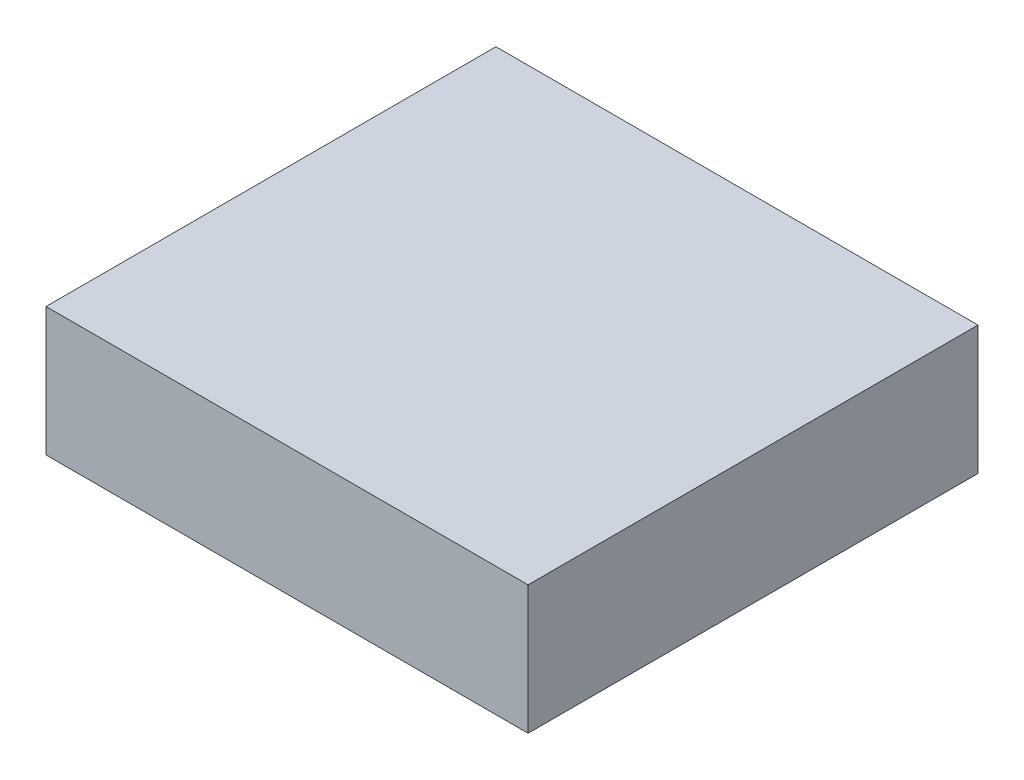
from build123d import *

# Parameters (mm, degrees)
SKETCH1_W           = 45
SKETCH1_H           = 42
BOSS_EXTRUDE1_DEPTH = 12


with BuildPart() as part:
    # Sketch1 → Boss-Extrude1 (new body)
    with BuildSketch(Plane(origin=(0, 0, 0), x_dir=(1, 0, 0), z_dir=(0, 1, 0))):
        with Locations((0.705128205, -4.58974359)):
            Rectangle(SKETCH1_W, SKETCH1_H)
    extrude(amount=BOSS_EXTRUDE1_DEPTH)


solid = part.part
